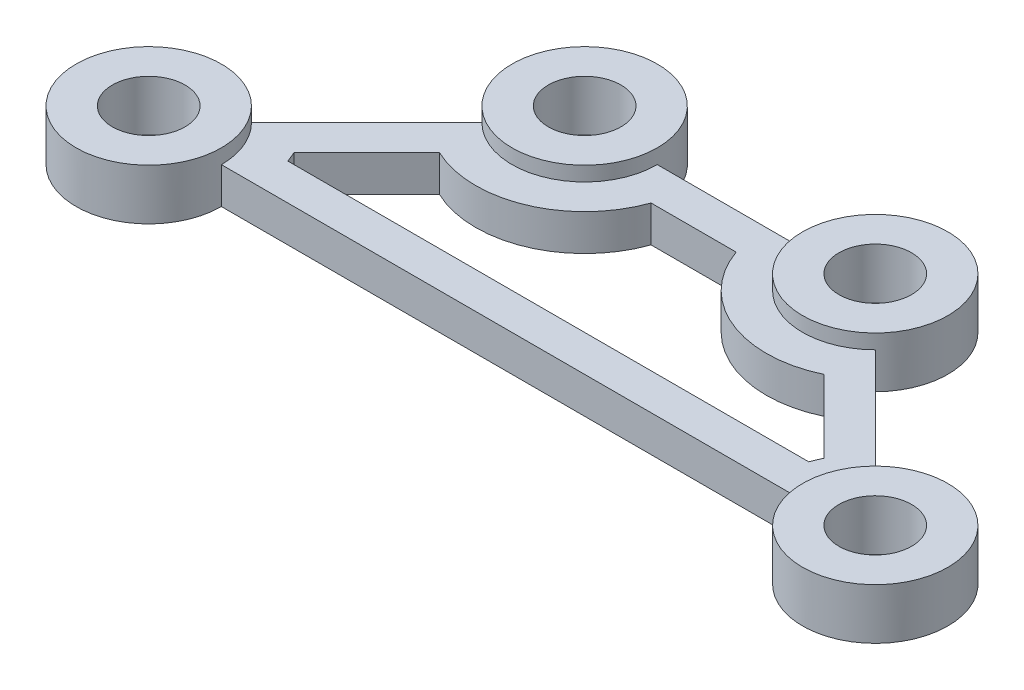
from build123d import *

# Parameters (mm, degrees)
SKETCH1_R               = 5
BOSS_EXTRUDE1_DEPTH     = 5
SKETCH1_3_R             = 10
SKETCH1_3_R_2           = 5
BOSS_EXTRUDE2_DEPTH     = 7
CUT_EXTRUDE1_DEPTH      = 68.268120235
CUT_EXTRUDE1_DEPTH_BACK = 68.268120235


with BuildPart() as part:
    # Sketch1 → Boss-Extrude1 (new body)
    with BuildSketch(Plane(origin=(0, 0, 0), x_dir=(1, 0, 0), z_dir=(0, 1, 0))):
        with BuildLine():
            ThreePointArc((-10, 10), (-23.826834324, 19.238795325), (-27.071067812, 2.928932188))
            Line((-27.071067812, 2.928932188), (-42.928932188, -12.928932188))
            ThreePointArc((-42.928932188, -12.928932188), (-59.238795325, -23.826834324), (-40, -20))
            Line((-40, -20), (40, -20))
            ThreePointArc((40, -20), (59.238795325, -23.826834324), (42.928932188, -12.928932188))
            Line((42.928932188, -12.928932188), (27.071067812, 2.928932188))
            ThreePointArc((27.071067812, 2.928932188), (23.826834324, 19.238795325), (10, 10))
            Line((10, 10), (-10, 10))
        make_face()
        with Locations((-20, 10)):
            Circle(SKETCH1_R, mode=Mode.SUBTRACT)
        with Locations((20, 10)):
            Circle(SKETCH1_R, mode=Mode.SUBTRACT)
        with Locations((50, -20)):
            Circle(SKETCH1_R, mode=Mode.SUBTRACT)
        with Locations((-50, -20)):
            Circle(SKETCH1_R, mode=Mode.SUBTRACT)
    extrude(amount=BOSS_EXTRUDE1_DEPTH)

    # Sketch1<3> → Boss-Extrude2 (add)
    # profile 1 of 4: a face of its own
    with BuildSketch(Plane(origin=(0, 0, 0), x_dir=(1, 0, 0), z_dir=(0, 1, 0))):
        with Locations((-50, -20)):
            Circle(SKETCH1_3_R)
        with Locations((-50, -20)):
            Circle(SKETCH1_3_R_2, mode=Mode.SUBTRACT)
    # profile 2 of 4: a face of its own
    with BuildSketch(Plane(origin=(0, 0, 0), x_dir=(1, 0, 0), z_dir=(0, 1, 0))):
        with Locations((-20, 10)):
            Circle(SKETCH1_3_R)
        with Locations((-20, 10)):
            Circle(SKETCH1_3_R_2, mode=Mode.SUBTRACT)
    # profile 3 of 4: a face of its own
    with BuildSketch(Plane(origin=(0, 0, 0), x_dir=(1, 0, 0), z_dir=(0, 1, 0))):
        with Locations((20, 10)):
            Circle(SKETCH1_3_R)
        with Locations((20, 10)):
            Circle(SKETCH1_3_R_2, mode=Mode.SUBTRACT)
    # profile 4 of 4: a face of its own
    with BuildSketch(Plane(origin=(0, 0, 0), x_dir=(1, 0, 0), z_dir=(0, 1, 0))):
        with Locations((50, -20)):
            Circle(SKETCH1_3_R)
        with Locations((50, -20)):
            Circle(SKETCH1_3_R_2, mode=Mode.SUBTRACT)
    extrude(amount=BOSS_EXTRUDE2_DEPTH)

    # Sketch3 → Cut-Extrude1 (cut, two sides: drawn at the far end of the back side and taken through both)
    with BuildSketch(Plane(origin=(0, 5, 0), x_dir=(1, 0, 0), z_dir=(0, 1, 0)).offset(-CUT_EXTRUDE1_DEPTH_BACK)):
        with BuildLine():
            Line((-35.857864376, -15), (35.857864376, -15))
            ThreePointArc((35.857864376, -15), (36.141807012, -14.259748515), (36.464466094, -13.535533906))
            Line((36.464466094, -13.535533906), (26.464466094, -3.535533906))
            ThreePointArc((26.464466094, -3.535533906), (14.259748515, -3.858192988), (5.857864376, 5))
            Line((5.857864376, 5), (-5.857864376, 5))
            ThreePointArc((-5.857864376, 5), (-14.259748515, -3.858192988), (-26.464466094, -3.535533906))
            Line((-26.464466094, -3.535533906), (-36.464466094, -13.535533906))
            ThreePointArc((-36.464466094, -13.535533906), (-36.141807012, -14.259748515), (-35.857864376, -15))
        make_face()
    extrude(amount=CUT_EXTRUDE1_DEPTH + CUT_EXTRUDE1_DEPTH_BACK, mode=Mode.SUBTRACT)


solid = part.part
